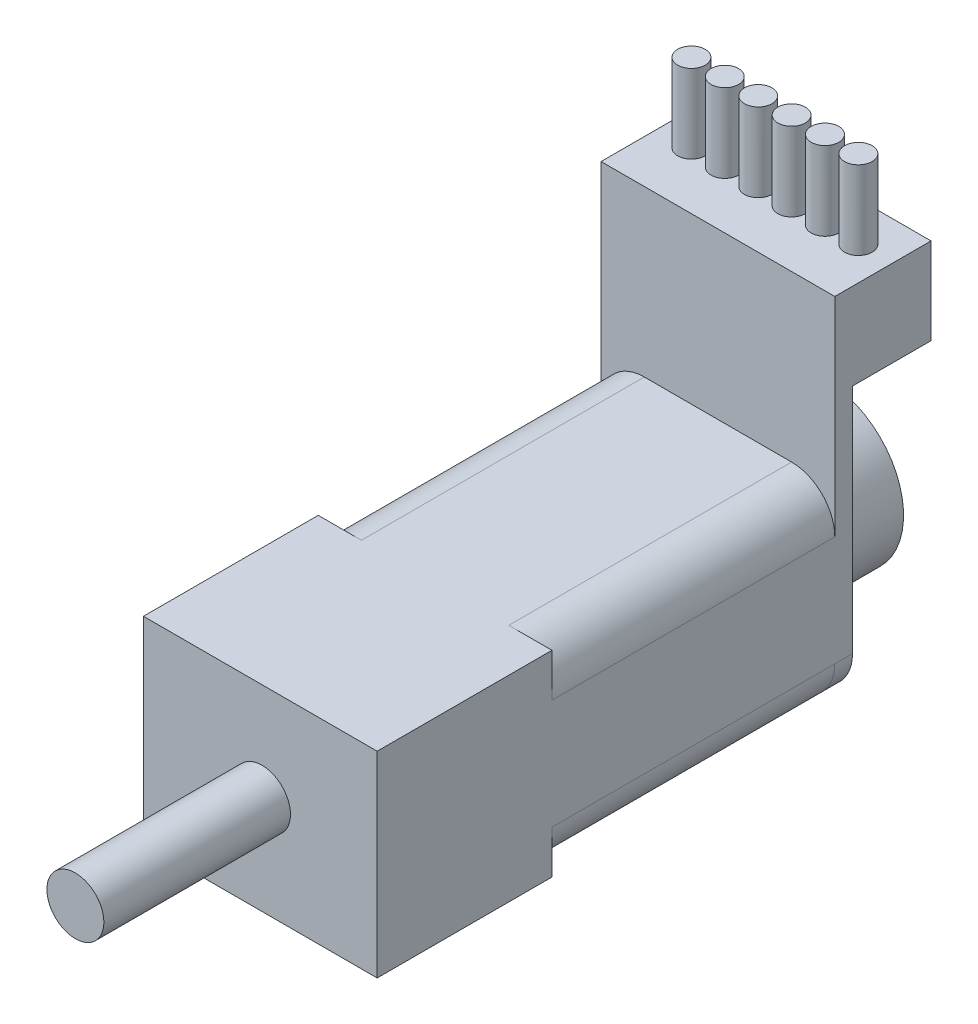
from build123d import *

# Parameters (mm, degrees)
SKETCH3_W           = 11.9
SKETCH3_H           = 10
BOSS_EXTRUDE1_DEPTH = 14.4
FILLET6_R           = 2.2
SKETCH6_W           = 11.9
SKETCH6_H           = 10
BOSS_EXTRUDE2_DEPTH = 8.9
SKETCH7_R           = 1.45
BOSS_EXTRUDE3_DEPTH = 9.5
SKETCH8_W           = 11.9
SKETCH8_H           = 18.4
BOSS_EXTRUDE4_DEPTH = 0.9
FILLET7_R           = 2.2
SKETCH9_R           = 4
BOSS_EXTRUDE6_DEPTH = 4.6
SKETCH10_W          = 11.9
SKETCH10_H          = 4.4
BOSS_EXTRUDE7_DEPTH = 4
SKETCH11_R          = 0.7
SKETCH11_R_2        = 0.702469816
SKETCH11_R_3        = 0.700963309
BOSS_EXTRUDE8_DEPTH = 4


with BuildPart() as part:
    # Sketch3 → Boss-Extrude1 (new body)
    with BuildSketch(Plane.XY):
        with Locations((5.95, 5)):
            Rectangle(SKETCH3_W, SKETCH3_H)
    extrude(amount=BOSS_EXTRUDE1_DEPTH)

    # Fillet6
    fillet6_edges = [part.edges().sort_by_distance(p)[0] for p in [
        (0, 10, 7.2),
        (11.9, 10, 7.2),
        (11.9, 0, 7.2),
        (0, 0, 7.2),
    ]]
    fillet(fillet6_edges, radius=FILLET6_R)

    # Sketch6 → Boss-Extrude2 (add)
    with BuildSketch(Plane.XY.offset(14.4)):
        with Locations((5.95, 5)):
            Rectangle(SKETCH6_W, SKETCH6_H)
    extrude(amount=BOSS_EXTRUDE2_DEPTH)

    # Sketch7 → Boss-Extrude3 (add)
    with BuildSketch(Plane.XY.offset(23.3)):
        with Locations((6.035152891, 5)):
            Circle(SKETCH7_R)
    extrude(amount=BOSS_EXTRUDE3_DEPTH)

    # Sketch8 → Boss-Extrude4 (add)
    with BuildSketch(Plane(origin=(0, 0, 0), x_dir=(-1, 0, 0), z_dir=(0, 0, -1))):
        with Locations((-5.95, 9.2)):
            Rectangle(SKETCH8_W, SKETCH8_H)
    extrude(amount=BOSS_EXTRUDE4_DEPTH)

    # Fillet7
    fillet7_edges = [part.edges().sort_by_distance(p)[0] for p in [
        (0, 0, -0.45),
        (11.9, 0, -0.45),
    ]]
    fillet(fillet7_edges, radius=FILLET7_R)

    # Sketch9 → Boss-Extrude6 (add)
    with BuildSketch(Plane(origin=(0, 0, -0.9), x_dir=(-1, 0, 0), z_dir=(0, 0, -1))):
        with Locations((-5.9, 5)):
            Circle(SKETCH9_R)
    extrude(amount=BOSS_EXTRUDE6_DEPTH)

    # Sketch10 → Boss-Extrude7 (add)
    with BuildSketch(Plane(origin=(0, 0, -0.9), x_dir=(-1, 0, 0), z_dir=(0, 0, -1))):
        with Locations((-5.95, 16.2)):
            Rectangle(SKETCH10_W, SKETCH10_H)
    extrude(amount=BOSS_EXTRUDE7_DEPTH)

    # Sketch11 → Boss-Extrude8 (add)
    with BuildSketch(Plane(origin=(0, 18.4, 0), x_dir=(1, 0, 0), z_dir=(0, 1, 0))):
        with Locations(Location((3.4, 2.9, 0), (0, 0, 90))):
            Circle(SKETCH11_R)
        with Locations(Location((5.1, 2.9, 0), (0, 0, 90))):
            Circle(SKETCH11_R)
        with Locations(Location((6.8, 2.9, 0), (0, 0, 90))):
            Circle(SKETCH11_R)
        with Locations(Location((8.5, 2.9, 0), (0, 0, 90))):
            Circle(SKETCH11_R_2)
        with Locations(Location((10.2, 2.9, 0), (0, 0, 90))):
            Circle(SKETCH11_R_3)
        with Locations(Location((1.7, 2.9, 0), (0, 0, 90))):
            Circle(SKETCH11_R)
    extrude(amount=BOSS_EXTRUDE8_DEPTH)


solid = part.part
